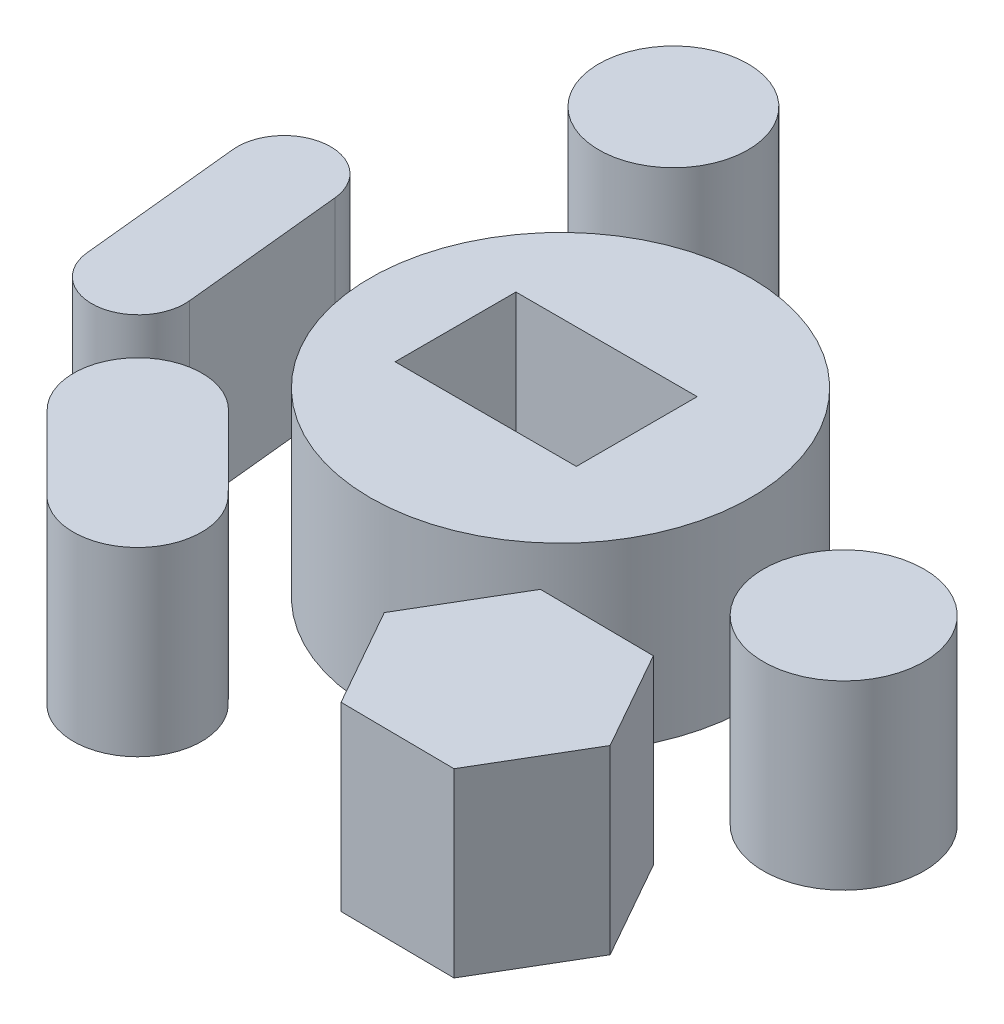
from build123d import *

# Parameters (mm, degrees)
SKETCH1_R             = 160.054383024
SKETCH1_W             = 152.4
SKETCH1_H             = 101.6
BOSS_EXTRUDE1_DEPTH   = 152.4
SKETCH1_R_2           = 67.546599545
BOSS_EXTRUDE1_2_DEPTH = 152.4
SKETCH1_R_3           = 62.72842728
BOSS_EXTRUDE1_3_DEPTH = 152.4
BOSS_EXTRUDE1_4_DEPTH = 152.4
BOSS_EXTRUDE1_5_DEPTH = 152.4
BOSS_EXTRUDE1_6_DEPTH = 152.4
SKETCH2_R             = 27.203777015
CUT_EXTRUDE1_DEPTH    = 38.1


with BuildPart() as part:
    # Sketch1 → Boss-Extrude1 (new body)
    with BuildSketch(Plane(origin=(0, 0, 0), x_dir=(1, 0, 0), z_dir=(0, 1, 0))):
        with Locations(Location((88.50543124, 50.578437179, 0), (0, 0, 90))):
            Circle(SKETCH1_R)
        with Locations((76.2, 50.8)):
            Rectangle(SKETCH1_W, SKETCH1_H, mode=Mode.SUBTRACT)
    extrude(amount=BOSS_EXTRUDE1_DEPTH)


with BuildPart() as body_2:
    # Sketch1 → Boss-Extrude1 2 (new body)
    with BuildSketch(Plane(origin=(0, 0, 0), x_dir=(1, 0, 0), z_dir=(0, 1, 0))):
        with Locations(Location((373.289947205, 3.911024814, 0), (0, 0, 90))):
            Circle(SKETCH1_R_2)
    extrude(amount=BOSS_EXTRUDE1_2_DEPTH)


with BuildPart() as body_3:
    # Sketch1 → Boss-Extrude1 3 (new body)
    with BuildSketch(Plane(origin=(0, 0, 0), x_dir=(1, 0, 0), z_dir=(0, 1, 0))):
        with Locations(Location((-68.638535942, 302.643214026, 0), (0, 0, 90))):
            Circle(SKETCH1_R_3)
    extrude(amount=BOSS_EXTRUDE1_3_DEPTH)


with BuildPart() as body_4:
    # Sketch1 → Boss-Extrude1 4 (new body)
    with BuildSketch(Plane(origin=(0, 0, 0), x_dir=(1, 0, 0), z_dir=(0, 1, 0))):
        Polygon((225.22648648, -270.660475239), (321.088205207, -271.580508421), (369.815836678, -189.021841345), (322.681749423, -105.543141086), (226.820030696, -104.623107904), (178.092399225, -187.18177498), align=None)
    extrude(amount=BOSS_EXTRUDE1_4_DEPTH)


with BuildPart() as body_5:
    # Sketch1 → Boss-Extrude1 5 (new body)
    with BuildSketch(Plane(origin=(0, 0, 0), x_dir=(1, 0, 0), z_dir=(0, 1, 0))):
        with BuildLine():
            Line((-144.715826236, 94.276120946), (-130.873948783, -42.06424919))
            ThreePointArc((-130.873948783, -42.06424919), (-165.942443278, -85.057964519), (-208.936158607, -49.989470025))
            Line((-208.936158607, -49.989470025), (-222.77803606, 86.350900111))
            ThreePointArc((-222.77803606, 86.350900111), (-187.709541566, 129.344615441), (-144.715826236, 94.276120946))
        make_face()
    extrude(amount=BOSS_EXTRUDE1_5_DEPTH)


with BuildPart() as body_6:
    # Sketch1 → Boss-Extrude1 6 (new body)
    with BuildSketch(Plane(origin=(0, 0, 0), x_dir=(1, 0, 0), z_dir=(0, 1, 0))):
        with BuildLine():
            Line((-49.404670277, -243.481375716), (-111.18669851, -181.436163559))
            ThreePointArc((-111.18669851, -181.436163559), (-111.024576314, -105.15816066), (-34.746573415, -105.320282856))
            Line((-34.746573415, -105.320282856), (27.035454818, -167.365495014))
            ThreePointArc((27.035454818, -167.365495014), (26.873332621, -243.643497912), (-49.404670277, -243.481375716))
        make_face()
    extrude(amount=BOSS_EXTRUDE1_6_DEPTH)

    # Sketch2 → Cut-Extrude1 (cut, symmetric)
    with BuildSketch(Plane(origin=(-146.546927918, 0, 145.925303875), x_dir=(0.7056022940885255, 0, 0.7086080740275332), z_dir=(-0.7086080740275332, 0, 0.7056022940885255))):
        with Locations((89.910225123, 73.76978969)):
            Circle(SKETCH2_R)
    extrude(amount=CUT_EXTRUDE1_DEPTH, both=True, mode=Mode.SUBTRACT)


solid = Compound([part.part, body_2.part, body_3.part, body_4.part, body_5.part, body_6.part])
